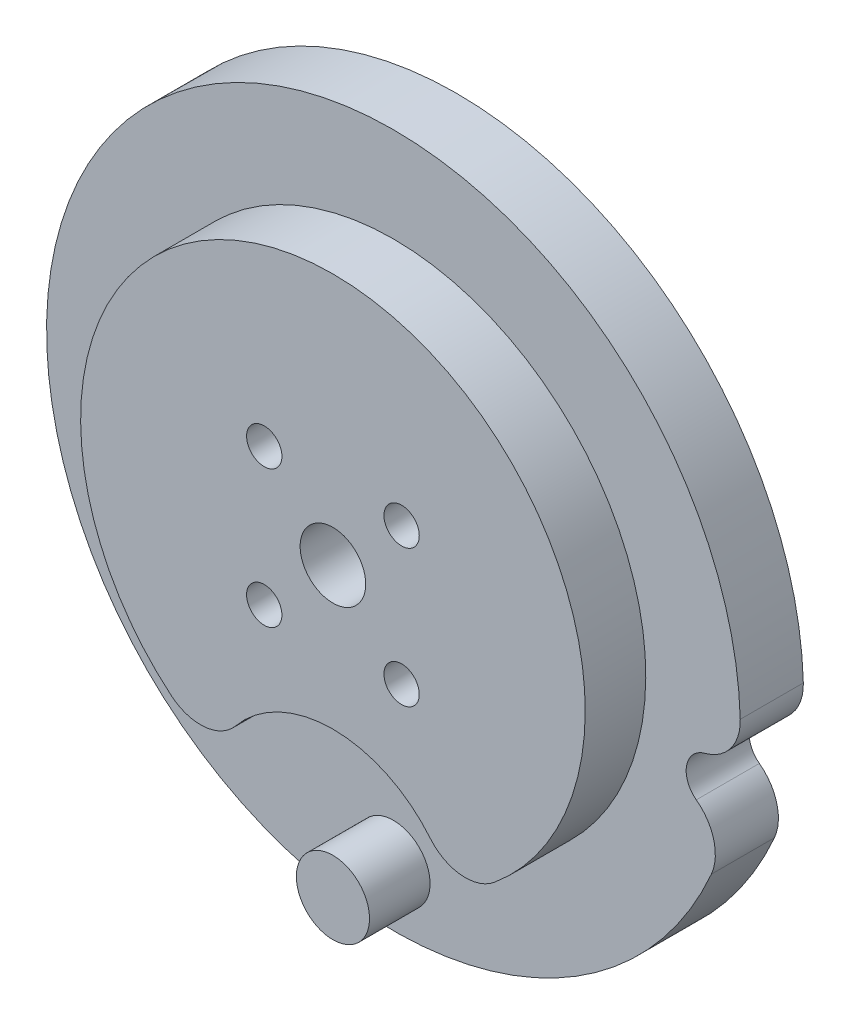
from build123d import *

# Parameters (mm, degrees)
SKETCH1_R           = 34.925
SKETCH1_R_2         = 1.778
BOSS_EXTRUDE1_DEPTH = 6.35
SKETCH2_R           = 3.683
SKETCH2_R_2         = 1.778
BOSS_EXTRUDE2_DEPTH = 6.096
SKETCH3_R           = 3.302
CUT_EXTRUDE1_DEPTH  = 51.935392077
FILLET1_R           = 4.572
SKETCH4_R           = 1.778
CUT_EXTRUDE2_DEPTH  = 51.935392238
SKETCH5_R           = 2.54
CUT_EXTRUDE3_DEPTH  = 51.935392238
FILLET2_R           = 4.7625


with BuildPart() as part:
    # Sketch1 → Boss-Extrude1 (new body)
    with BuildSketch(Plane.XY):
        Circle(SKETCH1_R)
        with Locations((-6.914797213, 6.914797213)):
            Circle(SKETCH1_R_2, mode=Mode.SUBTRACT)
        with Locations((6.914797213, 6.914797213)):
            Circle(SKETCH1_R_2, mode=Mode.SUBTRACT)
        with Locations((6.914797213, -6.914797213)):
            Circle(SKETCH1_R_2, mode=Mode.SUBTRACT)
        with Locations((-6.914797213, -6.914797213)):
            Circle(SKETCH1_R_2, mode=Mode.SUBTRACT)
    extrude(amount=BOSS_EXTRUDE1_DEPTH)

    # Sketch2 → Boss-Extrude2 (add)
    # profile 1 of 2: a face of its own
    with BuildSketch(Plane.XY.offset(6.35)):
        with Locations(Location((0, -28.971875, 0), (0, 0, 180))):
            Circle(SKETCH2_R)
    # profile 2 of 2: a face of its own
    with BuildSketch(Plane.XY.offset(6.35)):
        with BuildLine():
            ThreePointArc((11.864980378, -22.458455882), (0, 25.4), (-11.864980378, -22.458455882))
            ThreePointArc((-11.864980378, -22.458455882), (0, -14.2875), (11.864980378, -22.458455882))
        make_face()
        with Locations((-6.914797213, 6.914797213)):
            Circle(SKETCH2_R_2, mode=Mode.SUBTRACT)
        with Locations((6.914797213, 6.914797213)):
            Circle(SKETCH2_R_2, mode=Mode.SUBTRACT)
    extrude(amount=BOSS_EXTRUDE2_DEPTH)

    # Sketch3 → Cut-Extrude1 (cut, through all)
    with BuildSketch(Plane.XY.offset(12.446)):
        Circle(SKETCH3_R)
    extrude(amount=-CUT_EXTRUDE1_DEPTH, mode=Mode.SUBTRACT)

    # Fillet1
    fillet1_edges = [part.edges().sort_by_distance(p)[0] for p in [
        (-11.864980378, -22.458455882, 9.398),
        (11.864980378, -22.458455882, 9.398),
    ]]
    fillet(fillet1_edges, radius=FILLET1_R)

    # Sketch4 → Cut-Extrude2 (cut, through all)
    with BuildSketch(Plane(origin=(0, 0, 0), x_dir=(-1, 0, 0), z_dir=(0, 0, -1))):
        with Locations((-6.914797213, -6.914797213)):
            Circle(SKETCH4_R)
        with Locations((6.914797213, -6.914797213)):
            Circle(SKETCH4_R)
    extrude(amount=-CUT_EXTRUDE2_DEPTH, mode=Mode.SUBTRACT)

    # Sketch5 → Cut-Extrude3 (cut, through all)
    with BuildSketch(Plane(origin=(0, 0, 0), x_dir=(-1, 0, 0), z_dir=(0, 0, -1))):
        with Locations((-32.004, -6.223)):
            Circle(SKETCH5_R)
    extrude(amount=-CUT_EXTRUDE3_DEPTH, mode=Mode.SUBTRACT)

    # Fillet2
    fillet2_edges = [part.edges().sort_by_distance(p)[0] for p in [
        (34.470468913, -5.616261917, 3.175),
        (34.06339832, -7.709767823, 3.175),
    ]]
    fillet(fillet2_edges, radius=FILLET2_R)


solid = part.part
